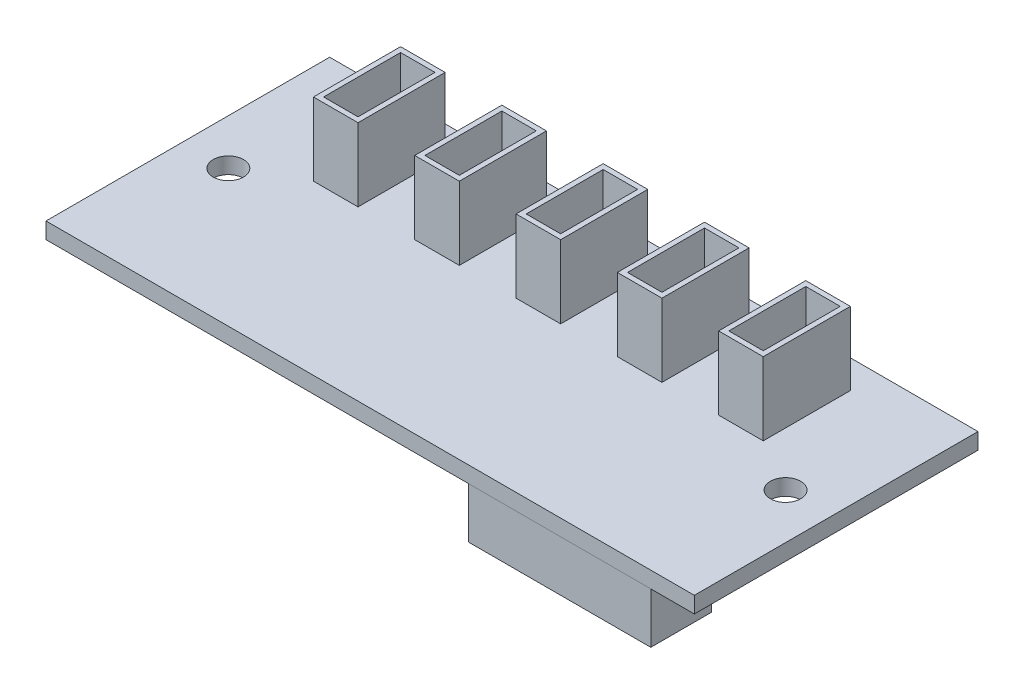
from build123d import *

# Parameters (mm, degrees)
SKETCH1_W             = 64
SKETCH1_H             = 28
SKETCH1_R             = 1.5
BOSS_EXTRUDE1_DEPTH   = 1.6
SKETCH2_W             = 4.4
SKETCH2_H             = 8.6
BOSS_EXTRUDE2_DEPTH   = 7.2
BOSS_EXTRUDE2_2_DEPTH = 7.2
BOSS_EXTRUDE2_3_DEPTH = 7.2
BOSS_EXTRUDE2_4_DEPTH = 7.2
BOSS_EXTRUDE2_5_DEPTH = 7.2
SHELL1_T              = -0.5
SHELL2_T              = -0.5
SHELL3_T              = -0.5
SHELL4_T              = -0.5
SHELL5_T              = -0.5
SKETCH3_W             = 18
SKETCH3_H             = 6
BOSS_EXTRUDE3_DEPTH   = 5


with BuildPart() as part:
    # Sketch1 → Boss-Extrude1 (new body)
    with BuildSketch(Plane(origin=(0, 0, 0), x_dir=(1, 0, 0), z_dir=(0, 1, 0))):
        Rectangle(SKETCH1_W, SKETCH1_H)
        with Locations(Location((27.5, -0.5, 0), (0, 0, 270))):
            Circle(SKETCH1_R, mode=Mode.SUBTRACT)
        with Locations(Location((-27.5, -0.5, 0), (0, 0, 270))):
            Circle(SKETCH1_R, mode=Mode.SUBTRACT)
    extrude(amount=BOSS_EXTRUDE1_DEPTH)


with BuildPart() as body_2:
    # Sketch2 → Boss-Extrude2 (new body)
    with BuildSketch(Plane(origin=(0, 1.6, 0), x_dir=(1, 0, 0), z_dir=(0, 1, 0))):
        with Locations((0, 6.9)):
            Rectangle(SKETCH2_W, SKETCH2_H)
    extrude(amount=BOSS_EXTRUDE2_DEPTH)

    # Shell3
    shell3_openings = [body_2.faces().sort_by_distance(p)[0] for p in [
        (0, 8.8, -6.9),
    ]]
    offset(amount=SHELL3_T, openings=shell3_openings, kind=Kind.INTERSECTION)


with BuildPart() as body_3:
    # Sketch2 → Boss-Extrude2 2 (new body)
    with BuildSketch(Plane(origin=(0, 1.6, 0), x_dir=(1, 0, 0), z_dir=(0, 1, 0))):
        with Locations((10, 6.9)):
            Rectangle(SKETCH2_W, SKETCH2_H)
    extrude(amount=BOSS_EXTRUDE2_2_DEPTH)

    # Shell4
    shell4_openings = [body_3.faces().sort_by_distance(p)[0] for p in [
        (10, 8.8, -6.9),
    ]]
    offset(amount=SHELL4_T, openings=shell4_openings, kind=Kind.INTERSECTION)


with BuildPart() as body_4:
    # Sketch2 → Boss-Extrude2 3 (new body)
    with BuildSketch(Plane(origin=(0, 1.6, 0), x_dir=(1, 0, 0), z_dir=(0, 1, 0))):
        with Locations((20, 6.9)):
            Rectangle(SKETCH2_W, SKETCH2_H)
    extrude(amount=BOSS_EXTRUDE2_3_DEPTH)

    # Shell5
    shell5_openings = [body_4.faces().sort_by_distance(p)[0] for p in [
        (20, 8.8, -6.9),
    ]]
    offset(amount=SHELL5_T, openings=shell5_openings, kind=Kind.INTERSECTION)


with BuildPart() as body_5:
    # Sketch2 → Boss-Extrude2 4 (new body)
    with BuildSketch(Plane(origin=(0, 1.6, 0), x_dir=(1, 0, 0), z_dir=(0, 1, 0))):
        with Locations((-10, 6.9)):
            Rectangle(SKETCH2_W, SKETCH2_H)
    extrude(amount=BOSS_EXTRUDE2_4_DEPTH)

    # Shell2
    shell2_openings = [body_5.faces().sort_by_distance(p)[0] for p in [
        (-10, 8.8, -6.9),
    ]]
    offset(amount=SHELL2_T, openings=shell2_openings, kind=Kind.INTERSECTION)


with BuildPart() as body_6:
    # Sketch2 → Boss-Extrude2 5 (new body)
    with BuildSketch(Plane(origin=(0, 1.6, 0), x_dir=(1, 0, 0), z_dir=(0, 1, 0))):
        with Locations((-20, 6.9)):
            Rectangle(SKETCH2_W, SKETCH2_H)
    extrude(amount=BOSS_EXTRUDE2_5_DEPTH)

    # Shell1
    shell1_openings = [body_6.faces().sort_by_distance(p)[0] for p in [
        (-20, 8.8, -6.9),
    ]]
    offset(amount=SHELL1_T, openings=shell1_openings, kind=Kind.INTERSECTION)


with BuildPart() as body_7:
    # Sketch3 → Boss-Extrude3 (new body)
    with BuildSketch(Plane.XZ):
        with Locations((18.7, 11)):
            Rectangle(SKETCH3_W, SKETCH3_H)
    extrude(amount=BOSS_EXTRUDE3_DEPTH)


solid = Compound([part.part, body_2.part, body_3.part, body_4.part, body_5.part, body_6.part, body_7.part])
